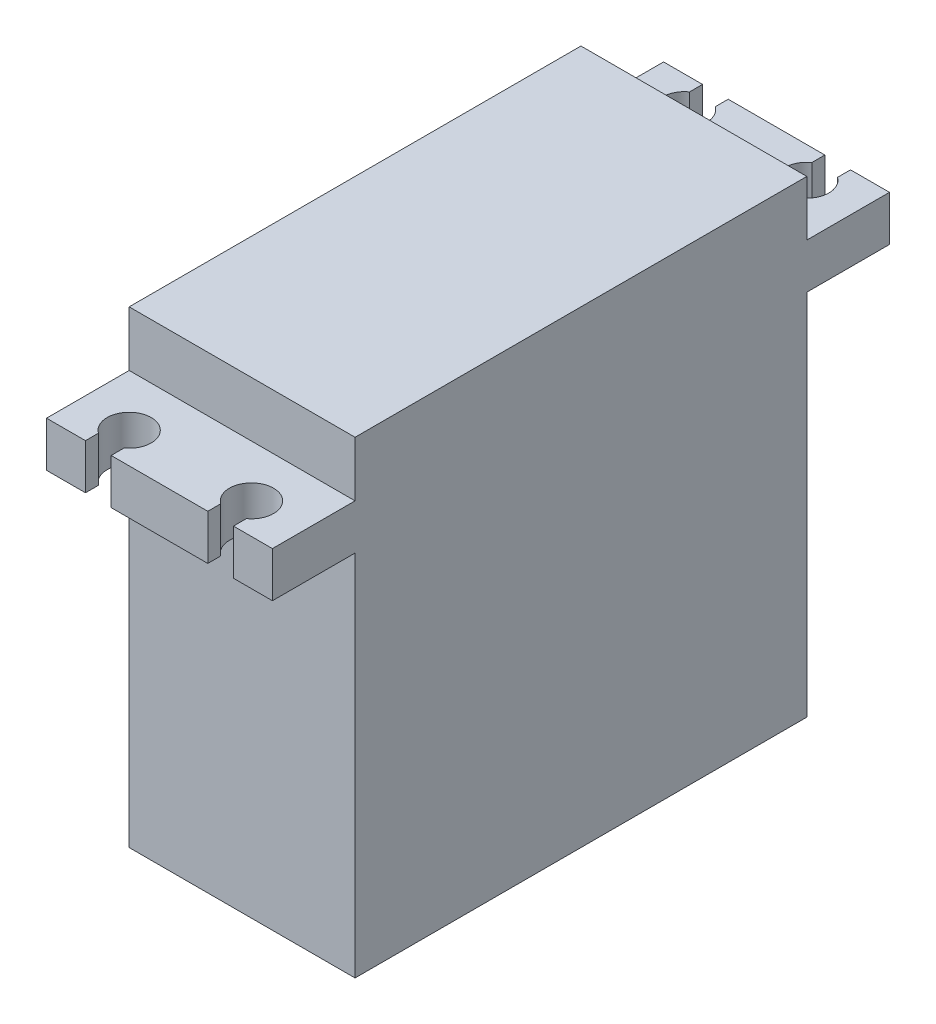
from build123d import *

# Parameters (mm, degrees)
SKETCH2_W           = 20.5
SKETCH2_H           = 41
BOSS_EXTRUDE1_DEPTH = 42.5
BOSS_EXTRUDE2_START = 33.4
BOSS_EXTRUDE2_DEPTH = 4.1


with BuildPart() as part:
    # Sketch2 → Boss-Extrude1 (new body)
    with BuildSketch(Plane(origin=(0, 0, 0), x_dir=(1, 0, 0), z_dir=(0, 1, 0))):
        Rectangle(SKETCH2_W, SKETCH2_H)
    extrude(amount=BOSS_EXTRUDE1_DEPTH)

    # Sketch2<3> → Boss-Extrude2 (add)
    with BuildSketch(Plane(origin=(0, 0, 0), x_dir=(1, 0, 0), z_dir=(0, 1, 0)).offset(BOSS_EXTRUDE2_START)):
        with BuildLine():
            Line((-10.25, 28), (-10.25, 20.5))
            Line((-10.25, 20.5), (10.25, 20.5))
            Line((10.25, 20.5), (10.25, 28))
            Line((10.25, 28), (6.715, 28))
            Line((6.715, 28), (6.715, 26.825661404))
            ThreePointArc((6.715, 26.825661404), (5.55, 23.2), (4.385, 26.825661404))
            Line((4.385, 26.825661404), (4.385, 28))
            Line((4.385, 28), (-4.385, 28))
            Line((-4.385, 28), (-4.385, 26.825661404))
            ThreePointArc((-4.385, 26.825661404), (-5.55, 23.2), (-6.715, 26.825661404))
            Line((-6.715, 26.825661404), (-6.715, 28))
            Line((-6.715, 28), (-10.25, 28))
        make_face()
        with BuildLine():
            Line((10.25, -20.5), (-10.25, -20.5))
            Line((-10.25, -20.5), (-10.25, -28))
            Line((-10.25, -28), (-6.715, -28))
            Line((-6.715, -28), (-6.715, -26.825661404))
            ThreePointArc((-6.715, -26.825661404), (-5.55, -23.2), (-4.385, -26.825661404))
            Line((-4.385, -26.825661404), (-4.385, -28))
            Line((-4.385, -28), (4.385, -28))
            Line((4.385, -28), (4.385, -26.825661404))
            ThreePointArc((4.385, -26.825661404), (5.55, -23.2), (6.715, -26.825661404))
            Line((6.715, -26.825661404), (6.715, -28))
            Line((6.715, -28), (10.25, -28))
            Line((10.25, -28), (10.25, -20.5))
        make_face()
    extrude(amount=BOSS_EXTRUDE2_DEPTH)


solid = part.part
